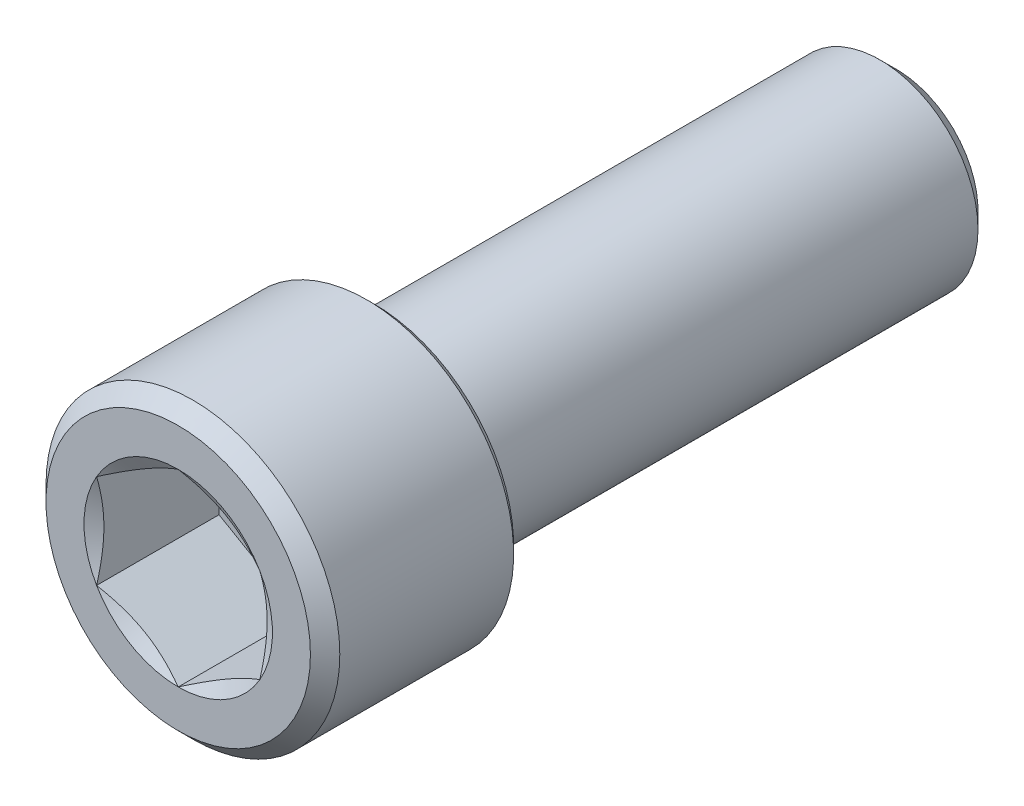
from build123d import *

# Parameters (mm, degrees)
CUT_EXTRUDE1_DEPTH = 5.953125
CHAMFER1_SIZE      = 0.714375
CHAMFER2_SIZE      = 0.3571875


with BuildPart() as part:
    # Sketch2 → Revolve1 (revolve)
    with BuildSketch(Plane(origin=(0, 0, 0), x_dir=(0, 0, -1), z_dir=(1, 0, 0))):
        Polygon((17.4625, 3.96875), (16.66875, 4.7625), (-7.9375, 4.7625), (-7.9375, 7.14375), (-17.4625, 7.14375), (-17.4625, 0), (17.4625, 0), align=None)
    revolve(axis=Axis((0, 0, -17.4625), (0, 0, 1)))

    # Sketch4 → Cut-Extrude1 (cut)
    with BuildSketch(Plane.XY.offset(17.4625)):
        Polygon((0, 4.582717762), (-3.96875, 2.291358881), (-3.96875, -2.291358881), (0, -4.582717762), (3.96875, -2.291358881), (3.96875, 2.291358881), align=None)
    extrude(amount=-CUT_EXTRUDE1_DEPTH, mode=Mode.SUBTRACT)

    # Cut-Extrude2 cone 1 section (through the dimple's axis) → Cut-Extrude2 (revolve, cut)
    with BuildSketch(Plane(origin=(0, 0, 17.4625), x_dir=(0, -1, 0), z_dir=(1, 0, 0))):
        Polygon((0, 0), (4.582717762, 0), (0, 2.645833333), align=None)
    revolve(axis=Axis((0, 0, 17.4625), (0, 0, -1)), mode=Mode.SUBTRACT)

    # Chamfer1
    chamfer1_edges = [part.edges().sort_by_distance(p)[0] for p in [
        (0, -7.14375, 17.4625),
    ]]
    chamfer(chamfer1_edges, length=CHAMFER1_SIZE)

    # Chamfer2
    chamfer2_edges = [part.edges().sort_by_distance(p)[0] for p in [
        (0, -7.14375, 7.9375),
    ]]
    chamfer(chamfer2_edges, length=CHAMFER2_SIZE)


solid = part.part
